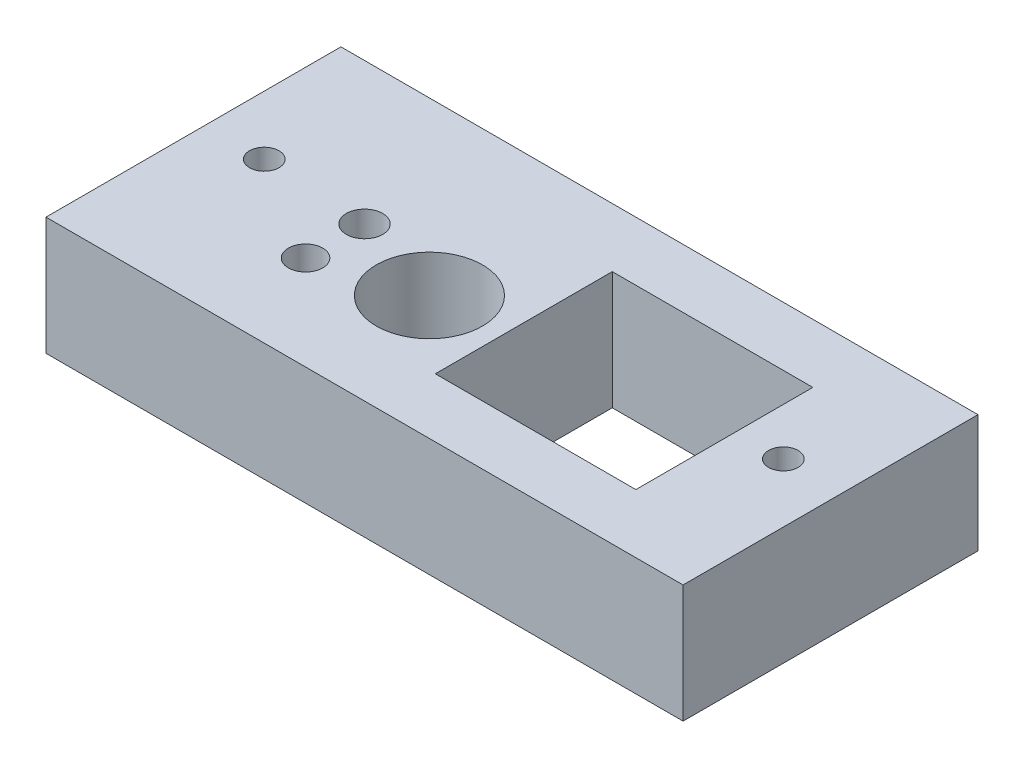
from build123d import *

# Parameters (mm, degrees)
SKETCH1_W           = 54
SKETCH1_H           = 25
BOSS_EXTRUDE1_DEPTH = 10
SKETCH2_R           = 1.25
SKETCH2_R_2         = 4.5
SKETCH2_R_3         = 1.541692257
SKETCH2_R_4         = 1.457345452
SKETCH2_W           = 17
SKETCH2_H           = 15
CUT_EXTRUDE1_DEPTH  = 10


with BuildPart() as part:
    # Sketch1 → Boss-Extrude1 (new body)
    with BuildSketch(Plane(origin=(0, 0, 0), x_dir=(1, 0, 0), z_dir=(0, 1, 0))):
        with Locations((27, 12.5)):
            Rectangle(SKETCH1_W, SKETCH1_H)
    extrude(amount=BOSS_EXTRUDE1_DEPTH)

    # Sketch2 → Cut-Extrude1 (cut)
    with BuildSketch(Plane(origin=(0, 10, 0), x_dir=(1, 0, 0), z_dir=(0, 1, 0))):
        with Locations(Location((49, 13.5, 0), (0, 0, 270))):
            Circle(SKETCH2_R)
        with Locations(Location((5, 13.5, 0), (0, 0, 270))):
            Circle(SKETCH2_R)
        with Locations(Location((22, 10.5, 0), (0, 0, 270))):
            Circle(SKETCH2_R_2)
        with Locations(Location((14, 13, 0), (0, 0, 270))):
            Circle(SKETCH2_R_3)
        with Locations(Location((14, 8, 0), (0, 0, 270))):
            Circle(SKETCH2_R_4)
        with Locations((36.5, 12.5)):
            Rectangle(SKETCH2_W, SKETCH2_H)
    extrude(amount=-CUT_EXTRUDE1_DEPTH, mode=Mode.SUBTRACT)


solid = part.part
